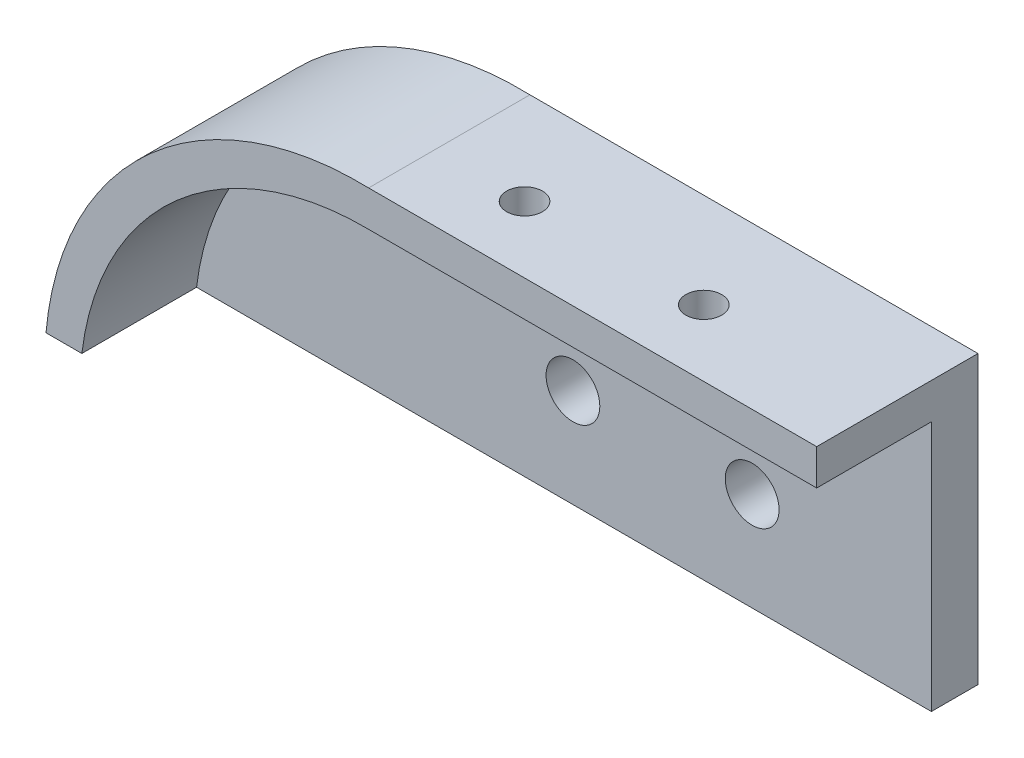
from build123d import *

# Parameters (mm, degrees)
SALIENTE_EXTRUIR1_DEPTH           = 4.5
CORTAR_EXTRUIR1_DEPTH             = 3.2
DI_METRO_DE_TALADRO_1_0_1_1_D     = 1
DI_METRO_DE_TALADRO_1_0_1_1_DEPTH = 8
DI_METRO_DE_TALADRO_1_5_1_5_1_D   = 1.5


with BuildPart() as part:
    # Croquis1 → Saliente-Extruir1 (new body)
    with BuildSketch(Plane.XY.offset(4.5)):
        with BuildLine():
            Line((-9, 0), (12.5, 0))
            Line((12.5, 0), (12.5, 8))
            Line((12.5, 8), (0, 8))
            ThreePointArc((0, 8), (-6.088245682, 5.786776392), (-9, 0))
        make_face()
    extrude(amount=-SALIENTE_EXTRUIR1_DEPTH)

    # Croquis2 → Cortar-Extruir1 (cut)
    with BuildSketch(Plane.XY.offset(4.5)):
        with BuildLine():
            Line((12.5, 7), (0, 7))
            ThreePointArc((0, 7), (-5.341079038, 5.032661758), (-8, 0))
            Line((-8, 0), (12.5, 0))
            Line((12.5, 0), (12.5, 7))
        make_face()
    extrude(amount=-CORTAR_EXTRUIR1_DEPTH, mode=Mode.SUBTRACT)

    # Diámetro de taladro Ø1.0 (1)1
    with Locations(Plane(origin=(0, 8, 0), x_dir=(1, 0, 0), z_dir=(0, 1, 0))):
        with Locations((2.5, -2.65), (7.5, -2.65)):
            Hole(DI_METRO_DE_TALADRO_1_0_1_1_D / 2, depth=DI_METRO_DE_TALADRO_1_0_1_1_DEPTH)

    # Diámetro de taladro Ø1.5 (1.5)1 (through all)
    with Locations(Plane.XY.offset(1.3)):
        with Locations((7.5, 2.75), (2.5, 2.75)):
            Hole(DI_METRO_DE_TALADRO_1_5_1_5_1_D / 2)


solid = part.part
